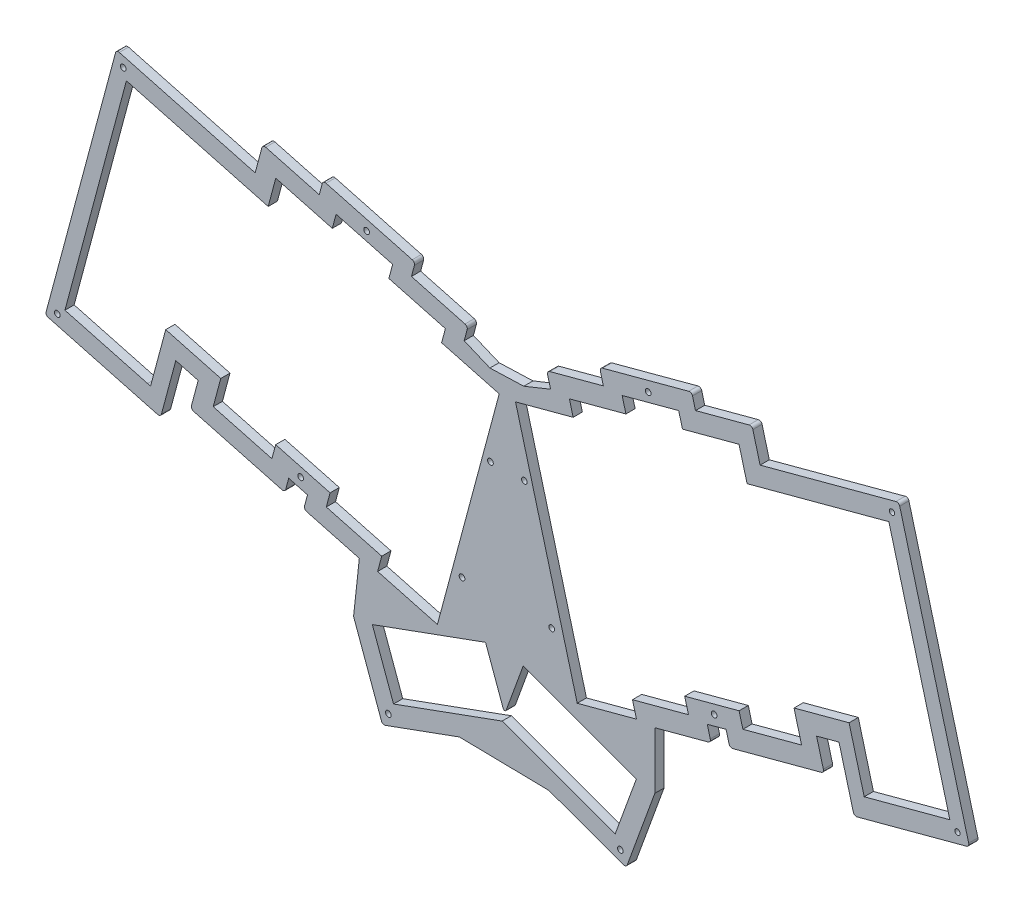
from build123d import *

# Parameters (mm, degrees)
MODEL_R             = 0.925
MODEL_R_2           = 0.875
BOSS_EXTRUDE1_DEPTH = 3
FILLET2_R           = 0.5
FILLET3_R           = 1


with BuildPart() as part:
    # Model → Boss-Extrude1 (new body)
    with BuildSketch(Plane.XY):
        Polygon((142.344747242, 270.871489374), (153.37187249, 271.263447748), (162.091473536, 274.767362889), (160.85900272, 279.367807803), (179.260689602, 284.297666211), (178.028627015, 288.898354165), (208.019481767, 296.93522173), (209.252454514, 292.334187025), (227.65276755, 297.263677376), (230.276304619, 287.470798216), (275.446186014, 299.571346393), (298.39980436, 213.909597233), (260.87259576, 203.855963236), (255.943287021, 222.255598366), (248.650938057, 220.301667543), (251.115775513, 211.101166572), (220.422247557, 202.878292884), (219.189771603, 207.477473721), (213.081966369, 205.841177268), (214.314693354, 201.241059665), (196.039346948, 196.343682115), (196.007810089, 177.840578221), (186.702312667, 152.27893851), (161.565977706, 161.426447529), (132.435827139, 161.934428279), (107.399642776, 152.824765622), (97.980730454, 178.710864183), (99.858189105, 195.997881416), (81.758593313, 200.846808858), (82.991121062, 205.447466285), (76.882860045, 207.083884844), (75.650856625, 202.485184579), (44.956891994, 210.708175253), (47.421773629, 219.90863481), (40.129543563, 221.862285479), (35.199939127, 203.463086712), (-2.32684459, 213.517448416), (20.785545351, 299.774827661), (65.955825932, 287.671594898), (68.42160019, 296.872525865), (86.820985153, 291.940533454), (88.054439652, 296.542595671), (118.044472643, 288.503706576), (116.812112756, 283.905728394), (135.211333861, 278.973779905), (133.979081507, 274.376202933), align=None)
        with Locations((23.035554, 295.877718337)):
            Circle(MODEL_R, mode=Mode.SUBTRACT)
        with Locations((109.301822433, 156.902965293)):
            Circle(MODEL_R, mode=Mode.SUBTRACT)
        with Locations((184.800560745, 156.35733766)):
            Circle(MODEL_R, mode=Mode.SUBTRACT)
        with Locations((193.847437398, 289.84318413)):
            Circle(MODEL_R, mode=Mode.SUBTRACT)
        with Locations((102.225689846, 289.449650012)):
            Circle(MODEL_R, mode=Mode.SUBTRACT)
        with Locations((273.19609114, 295.674286852)):
            Circle(MODEL_R_2, mode=Mode.SUBTRACT)
        with Locations((1.570241786, 215.767496811)):
            Circle(MODEL_R, mode=Mode.SUBTRACT)
        with Locations((294.502731407, 216.159668876)):
            Circle(MODEL_R_2, mode=Mode.SUBTRACT)
        with Locations((80.760413887, 209.339268578)):
            Circle(MODEL_R, mode=Mode.SUBTRACT)
        with Locations((215.312231294, 209.732861073)):
            Circle(MODEL_R, mode=Mode.SUBTRACT)
        with Locations((133.281102646, 207.339464548)):
            Circle(MODEL_R, mode=Mode.SUBTRACT)
        with Locations((162.46850521, 207.598897954)):
            Circle(MODEL_R, mode=Mode.SUBTRACT)
        with Locations((142.522359716, 244.531276159)):
            Circle(MODEL_R, mode=Mode.SUBTRACT)
        with Locations((153.549484965, 244.723703681)):
            Circle(MODEL_R, mode=Mode.SUBTRACT)
        Polygon((241.30271159, 224.544411578), (243.767491017, 215.34412721), (224.664804007, 210.226469096), (223.432328054, 214.825649934), (205.733277658, 210.084029615), (206.966112962, 205.483507804), (188.744476932, 200.600523414), (190.038361872, 195.770837942), (170.765567452, 190.607607624), (150.690394167, 265.500431998), (169.439649748, 270.524806438), (168.207287216, 275.124847165), (186.60841776, 280.054556529), (185.376246939, 284.655648642), (203.777033628, 289.586641337), (205.009898064, 284.986010813), (223.409806911, 289.915392881), (226.033325469, 280.122582817), (271.203498451, 292.223209107), (272.169435546, 292.481986095), (292.017165355, 218.411256738), (291.05122826, 218.15247975), (265.115556398, 211.204247731), (264.149619304, 210.945470743), (259.219574531, 229.345102127), align=None, mode=Mode.SUBTRACT)
        Polygon((91.063082461, 284.591613875), (72.663861356, 289.523562363), (70.198239559, 280.323200295), (25.028202346, 292.426367848), (24.062275945, 292.68518475), (4.05571522, 218.019020829), (5.0216469, 217.76022363), (30.957132238, 210.811459981), (31.923058639, 210.55264308), (36.852366702, 228.951863077), (54.770081908, 224.151554257), (52.305208977, 214.951127188), (71.407895987, 209.833469074), (72.639899407, 214.432169339), (90.339405557, 209.690426923), (89.106877808, 205.089769496), (107.149713912, 200.256048118), (105.814746135, 195.273012707), (125.26498777, 190.062243831), (145.381260936, 265.108396206), (126.630323598, 270.134062294), (127.862619282, 274.731800932), (109.463398178, 279.663749421), (110.695758065, 284.261727603), (92.29653696, 289.193676092), align=None, mode=Mode.SUBTRACT)
        Polygon((104.096364698, 179.45072575), (110.986427135, 160.514692668), (131.428930231, 167.95289908), (146.304188304, 173.365408471), (162.674398087, 167.40803076), (183.116533861, 159.968814913), (190.009613349, 178.903688177), (153.172596304, 192.31106529), (147.151959777, 175.767027333), (140.930891121, 192.858221652), align=None, mode=Mode.SUBTRACT)
    extrude(amount=-BOSS_EXTRUDE1_DEPTH)

    # Fillet2
    fillet2_edges = [part.edges().sort_by_distance(p)[0] for p in [
        (147.151959777, 175.767027333, -1.5),
    ]]
    fillet(fillet2_edges, radius=FILLET2_R)

    # Fillet3
    fillet3_edges = [part.edges().sort_by_distance(p)[0] for p in [
        (-2.32684459, 213.517448416, -1.5),
        (20.785545351, 299.774827661, -1.5),
        (68.42160019, 296.872525865, -1.5),
        (88.054439652, 296.542595671, -1.5),
        (118.044472643, 288.503706576, -1.5),
        (135.211333861, 278.973779905, -1.5),
        (160.85900272, 279.367807803, -1.5),
        (178.028627015, 288.898354165, -1.5),
        (208.019481767, 296.93522173, -1.5),
        (227.65276755, 297.263677376, -1.5),
        (275.446186014, 299.571346393, -1.5),
        (298.39980436, 213.909597233, -1.5),
        (260.87259576, 203.855963236, -1.5),
        (251.115775513, 211.101166572, -1.5),
        (220.422247557, 202.878292884, -1.5),
        (214.314693354, 201.241059665, -1.5),
        (186.702312667, 152.27893851, -1.5),
        (107.399642776, 152.824765622, -1.5),
        (81.758593313, 200.846808858, -1.5),
        (75.650856625, 202.485184579, -1.5),
        (44.956891994, 210.708175253, -1.5),
        (35.199939127, 203.463086712, -1.5),
    ]]
    fillet(fillet3_edges, radius=FILLET3_R)


solid = part.part
